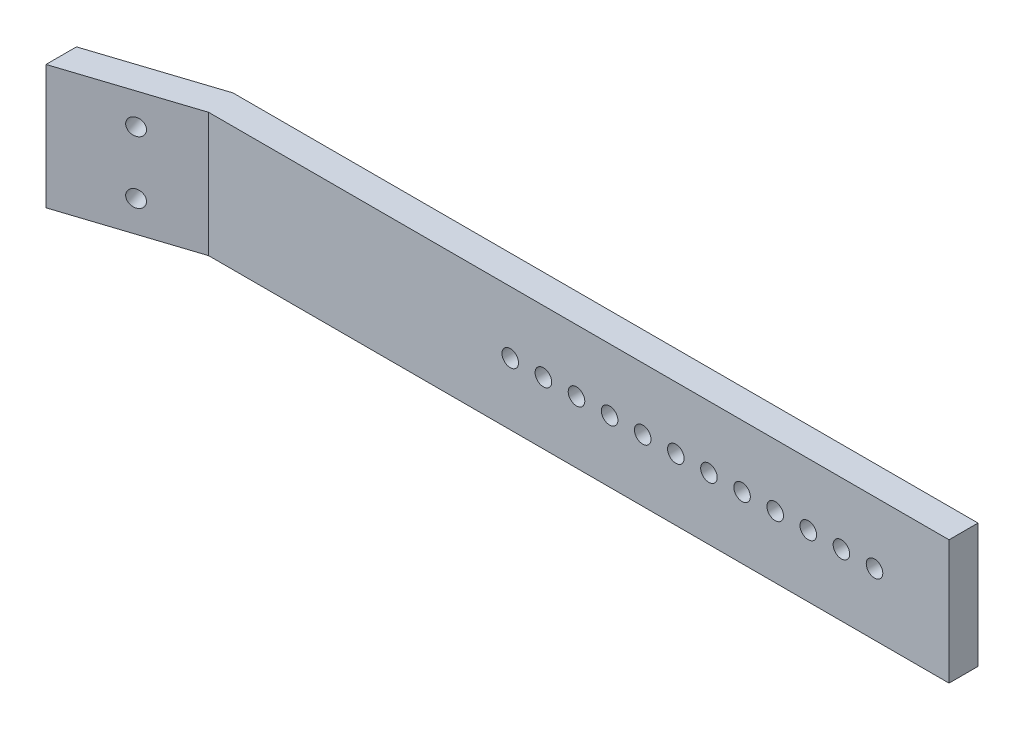
from build123d import *

# Parameters (mm, degrees)
SKETCH1_W           = 230
SKETCH1_H           = 30
BOSS_EXTRUDE1_DEPTH = 50
CUT_EXTRUDE1_DEPTH  = 50
SKETCH3_W           = 21.468304511
SKETCH3_H           = 50
CUT_EXTRUDE2_DEPTH  = 50
CUT_EXTRUDE3_DEPTH  = 50
SKETCH5_R           = 2
CUT_EXTRUDE4_DEPTH  = 50
SKETCH6_R           = 2
CUT_EXTRUDE5_DEPTH  = 50


with BuildPart() as part:
    # Sketch1 → Boss-Extrude1 (new body)
    with BuildSketch(Plane.XY):
        Rectangle(SKETCH1_W, SKETCH1_H)
    extrude(amount=BOSS_EXTRUDE1_DEPTH)

    # Sketch2 → Cut-Extrude1 (cut)
    with BuildSketch(Plane.XZ.offset(15)):
        Polygon((-115, 9.270509831), (-86.468304511, 0), (-115, 0), align=None)
    extrude(amount=-CUT_EXTRUDE1_DEPTH, mode=Mode.SUBTRACT)

    # Sketch3 → Cut-Extrude2 (cut)
    with BuildSketch(Plane.XZ.offset(15)):
        with Locations((104.265847745, 25)):
            Rectangle(SKETCH3_W, SKETCH3_H)
    extrude(amount=-CUT_EXTRUDE2_DEPTH, mode=Mode.SUBTRACT)

    # Sketch4 → Cut-Extrude3 (cut)
    with BuildSketch(Plane.XZ.offset(15)):
        Polygon((-115, 16.630745401), (-85.359613429, 7), (93.531695489, 7), (93.531695489, 50), (-115, 50), align=None)
    extrude(amount=-CUT_EXTRUDE3_DEPTH, mode=Mode.SUBTRACT)

    # Sketch5 → Cut-Extrude4 (cut)
    with BuildSketch(Plane(origin=(-8.256988343, 0, -25.412397091), x_dir=(-0.9510565162951533, 0, 0.3090169943749483), z_dir=(-0.3090169943749483, 0, -0.9510565162951534))):
        with Locations((97.236244458, 7.5)):
            Circle(SKETCH5_R)
        with Locations((97.236244458, -7.5)):
            Circle(SKETCH5_R)
    extrude(amount=-CUT_EXTRUDE4_DEPTH, mode=Mode.SUBTRACT)

    # Sketch6 → Cut-Extrude5 (cut)
    with BuildSketch(Plane(origin=(0, 0, 0), x_dir=(-1, 0, 0), z_dir=(0, 0, -1))):
        with Locations((-51.531695489, 0)):
            Circle(SKETCH6_R)
        with Locations((-59.531695489, 0)):
            Circle(SKETCH6_R)
        with Locations((-67.531695489, 0)):
            Circle(SKETCH6_R)
        with Locations((-75.531695489, 0)):
            Circle(SKETCH6_R)
        with Locations((-43.531695489, 0)):
            Circle(SKETCH6_R)
        with Locations((-35.531695489, 0)):
            Circle(SKETCH6_R)
        with Locations((-27.531695489, 0)):
            Circle(SKETCH6_R)
        with Locations((-19.531695489, 0)):
            Circle(SKETCH6_R)
        with Locations((-11.531695489, 0)):
            Circle(SKETCH6_R)
        with Locations((-3.531695489, 0)):
            Circle(SKETCH6_R)
        with Locations((4.468304511, 0)):
            Circle(SKETCH6_R)
        with Locations((12.468304511, 0)):
            Circle(SKETCH6_R)
    extrude(amount=-CUT_EXTRUDE5_DEPTH, mode=Mode.SUBTRACT)


solid = part.part
